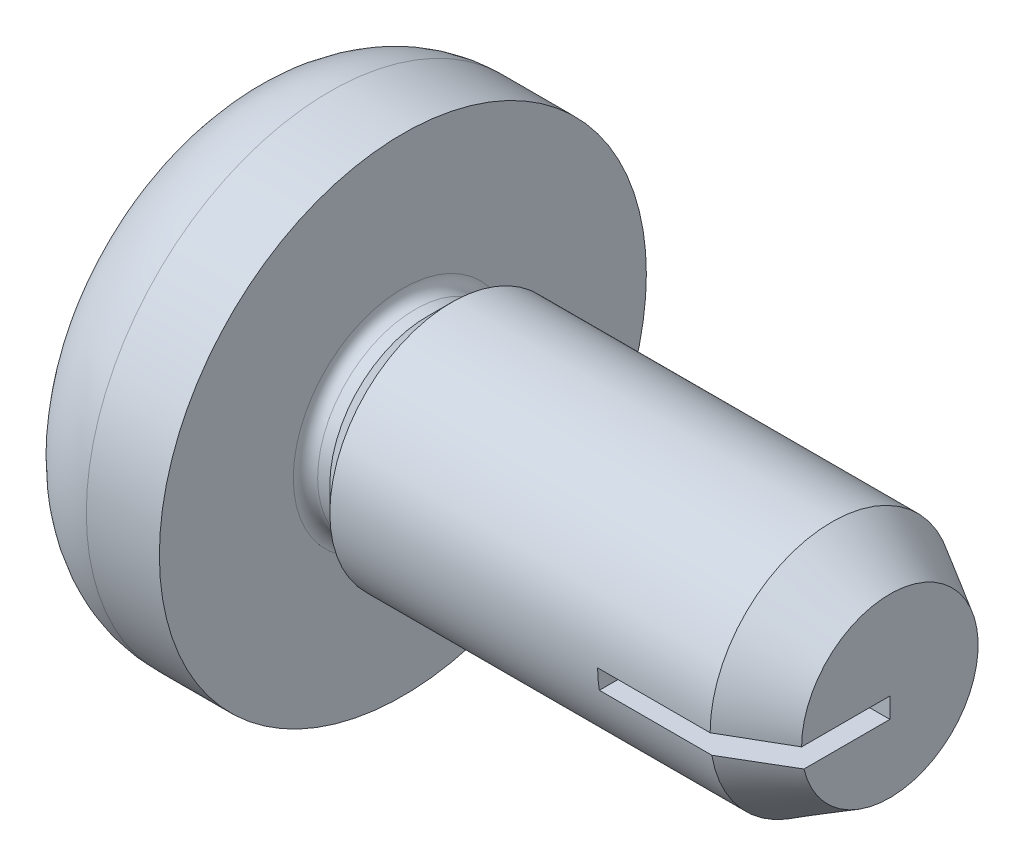
from build123d import *

# Parameters (mm, degrees)
CUT_EXTRUDE3_DEPTH         = 0.95
DRAFT1_ANGLE               = 20
RECESSI_CUT_EXTRUDE5_DEPTH = 0.95
SKETCH11_W                 = 1.4
SKETCH11_H                 = 0.166666667
POINT_CUT_EXTRUDE8_DEPTH   = 7.095900262


with BuildPart() as part:
    # Sketch1 → base-Revolve (revolve)
    with BuildSketch(Plane.XY, mode=Mode.PRIVATE) as base_revolve_sk:
        with BuildLine():
            Line((0, 0), (0, 1.2))
            ThreePointArc((0, 1.2), (0.234314575, 1.765685425), (0.8, 2))
            Line((0.8, 2), (1.4, 2))
            Line((1.4, 2), (1.4, 0.9))
            ThreePointArc((1.4, 0.9), (1.429289322, 0.829289322), (1.5, 0.8))
            Line((1.5, 0.8), (1.6, 0.8))
            Line((1.6, 0.8), (1.8, 1))
            Line((1.8, 1), (5.4, 1))
            Line((5.4, 1), (5.4, 0))
            Line((5.4, 0), (0, 0))
        make_face()
    revolve(base_revolve_sk.sketch.rotate(Axis((0, 0, 0), (1, 0, 0)), 90), axis=Axis((0, 0, 0), (1, 0, 0)))

    # Sketch4 → Cut-Extrude3 (cut)
    with BuildSketch(Plane(origin=(0, 0, 0), x_dir=(0, 0, -1), z_dir=(1, 0, 0))):
        Polygon((0.265, 1.07), (-0.265, 1.07), (-0.265, 0.265), (-1.07, 0.265), (-1.07, -0.265), (-0.265, -0.265), (-0.265, -1.07), (0.265, -1.07), (0.265, -0.265), (1.07, -0.265), (1.07, 0.265), (0.265, 0.265), align=None)
    extrude(amount=CUT_EXTRUDE3_DEPTH, mode=Mode.SUBTRACT)

    # Draft1
    draft1_faces = [part.faces().sort_by_distance(p)[0] for p in [
        (0.475, 0, -1.07),
        (0.475, -1.07, 0),
        (0.475, 0, 1.07),
        (0.475, 1.07, 0),
    ]]
    draft(draft1_faces, Plane(origin=(0, 0, 0), x_dir=(0, 0, -1), z_dir=(-1, 0, 0)), DRAFT1_ANGLE)

    # Sketch5 → recessI_Cut-Extrude5 (cut)
    with BuildSketch(Plane.ZY):
        Polygon((0.265, 0.479), (0.479, 0.265), (0.265, 0.265), align=None)
        Polygon((-0.265, 0.265), (-0.479, 0.265), (-0.265, 0.479), align=None)
        Polygon((-0.265, -0.479), (-0.479, -0.265), (-0.265, -0.265), align=None)
        Polygon((0.265, -0.265), (0.479, -0.265), (0.265, -0.479), align=None)
    extrude(amount=-RECESSI_CUT_EXTRUDE5_DEPTH, mode=Mode.SUBTRACT)

    # Sketch8 → point_Cut-Revolve1 (revolve, cut)
    with BuildSketch(Plane.XY, mode=Mode.PRIVATE) as point_cut_revolve1_sk:
        Polygon((5.4, 0), (5.908, 0), (5.908, 1.508), (4.923686028, 1.508), (4.923686028, 1), (5.4, 0.725), align=None)
    revolve(point_cut_revolve1_sk.sketch.rotate(Axis((0, 0, 0), (1, 0, 0)), 90), axis=Axis((0, 0, 0), (1, 0, 0)), mode=Mode.SUBTRACT)

    # Sketch11 → point_Cut-Extrude8 (cut, through all)
    with BuildSketch(Plane.XY):
        with Locations((4.7, -0.083333334)):
            Rectangle(SKETCH11_W, SKETCH11_H)
    extrude(amount=POINT_CUT_EXTRUDE8_DEPTH, mode=Mode.SUBTRACT)


solid = part.part
